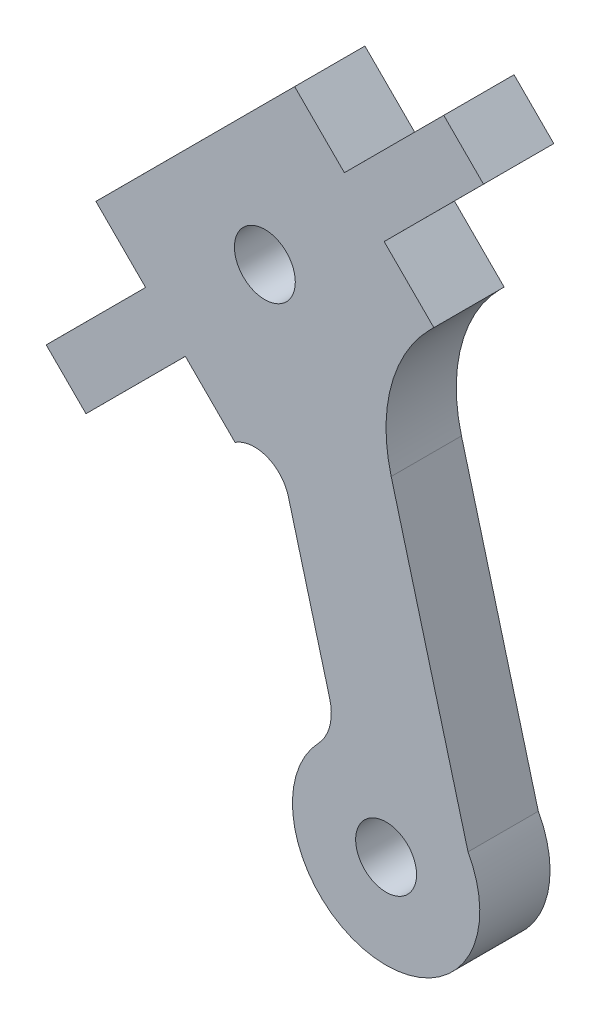
from build123d import *

# Parameters (mm, degrees)
SKETCH_1_R      = 1.3
EXTRUDE_1_DEPTH = 3


with BuildPart() as part:
    # 草图1 → 凸台-拉伸1 (new body)
    with BuildSketch(Plane(origin=(0, 0, -3.362857667), x_dir=(-1, 0, 0), z_dir=(0, 0, -1))):
        with BuildLine():
            Line((-6.304159928, 7.933833034), (-4.539684391, 14.518557193))
            ThreePointArc((-4.539684391, 14.518557193), (-3.62301138, 15.532716808), (-2.264294404, 15.382060533))
            Line((-2.264294404, 15.382060533), (-0.142530428, 17.503217342))
            Line((-0.142530428, 17.503217342), (4.099819599, 13.25965297))
            Line((4.099819599, 13.25965297), (5.796991646, 14.956339352))
            Line((5.796991646, 14.956339352), (1.554014804, 19.200530718))
            Line((1.554014804, 19.200530718), (3.675778781, 21.321687528))
            Line((3.675778781, 21.321687528), (-4.808443123, 29.808337985))
            Line((-4.808443123, 29.808337985), (-6.931968366, 27.685420414))
            Line((-6.931968366, 27.685420414), (-11.174318393, 31.928984786))
            Line((-11.174318393, 31.928984786), (-12.870428791, 30.231215419))
            Line((-12.870428791, 30.231215419), (-8.629080401, 25.98865297))
            Line((-8.629080401, 25.98865297), (-10.750844377, 23.867496161))
            Line((-10.750844377, 23.867496161), (-10.611098311, 23.731253658))
            ThreePointArc((-10.611098311, 23.731253658), (-8.929299443, 20.817545637), (-8.929456987, 17.45330102))
            Line((-8.929456987, 17.45330102), (-12.208534908, 5.216337034))
            ThreePointArc((-12.208534908, 5.216337034), (-8.203956956, -0.691485495), (-5.819308033, 6.03550946))
            ThreePointArc((-5.819308033, 6.03550946), (-6.310108859, 6.921233679), (-6.304159928, 7.933833034))
        make_face()
        with Locations(Location((-8.71249984, 3.274951558, 0), (0, 0, 180))):
            Circle(SKETCH_1_R, mode=Mode.SUBTRACT)
        with Locations(Location((-3.536567574, 22.593983824, 0), (0, 0, 180))):
            Circle(SKETCH_1_R, mode=Mode.SUBTRACT)
    extrude(amount=-EXTRUDE_1_DEPTH)


solid = part.part
